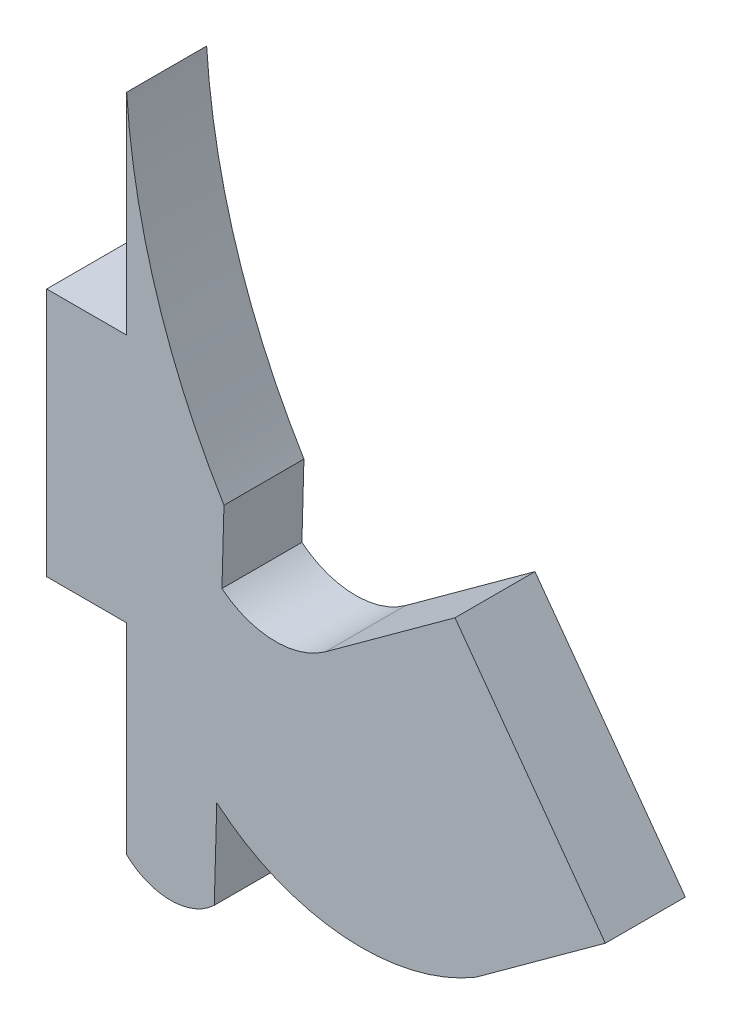
from build123d import *

# Parameters (mm, degrees)
BOSS_EXTRUDE1_DEPTH = 1.524


with BuildPart() as part:
    # Sketch1 → Boss-Extrude1 (new body)
    with BuildSketch(Plane.XY):
        with BuildLine():
            Line((1.524, 26.967680282), (0, 26.967680282))
            Line((0, 26.967680282), (0, 22.217880282))
            Line((0, 22.217880282), (1.524, 22.217880282))
            Line((1.524, 22.217880282), (1.524, 18.391271339))
            ThreePointArc((1.524, 18.391271339), (2.358852733, 18.057327031), (3.193705465, 18.391271339))
            Line((3.193705465, 18.391271339), (3.241105721, 20.110110457))
            ThreePointArc((3.241105721, 20.110110457), (5.645287311, 19.111172108), (8.181482071, 19.699120308))
            Line((8.181482071, 19.699120308), (10.646545317, 21.491818606))
            Line((10.646545317, 21.491818606), (7.781599903, 25.431283294))
            Line((7.781599903, 25.431283294), (5.316536657, 23.638584995))
            ThreePointArc((5.316536657, 23.638584995), (4.31894521, 23.329334303), (3.339913307, 23.693094141))
            Line((3.339913307, 23.693094141), (3.378365348, 25.087450992))
            ThreePointArc((3.378365348, 25.087450992), (2.095759725, 27.920506851), (1.524, 30.977363652))
            Line((1.524, 30.977363652), (1.524, 26.967680282))
        make_face()
    extrude(amount=BOSS_EXTRUDE1_DEPTH)


solid = part.part
